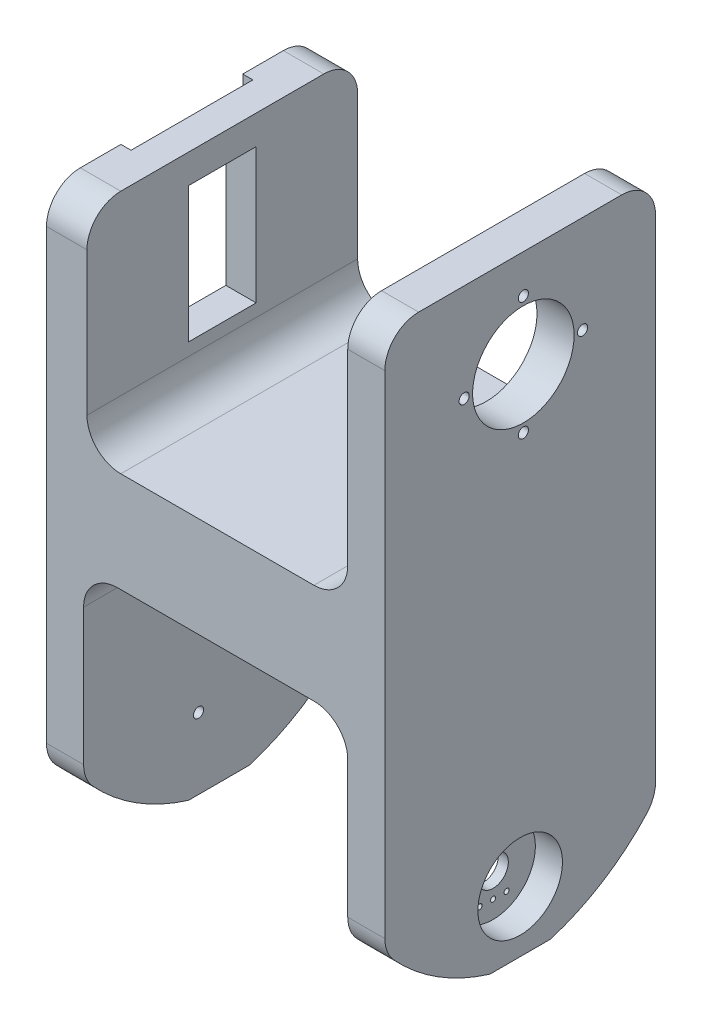
from build123d import *

# Parameters (mm, degrees)
SKETCH1_W           = 80
SKETCH1_H           = 180
BOSS_EXTRUDE1_DEPTH = 100
SKETCH2_W           = 78.07363092
SKETCH2_H           = 74.951044638
CUT_EXTRUDE1_DEPTH  = 90
SKETCH3_R           = 12.5
CUT_EXTRUDE2_DEPTH  = 8
SKETCH4_R           = 0.75
CUT_EXTRUDE3_DEPTH  = 8
SKETCH5_R           = 1.5
CUT_EXTRUDE4_DEPTH  = 18
CUT_EXTRUDE5_DEPTH  = 110
SKETCH8_W           = 78.07363092
SKETCH8_H           = 150.808878852
CUT_EXTRUDE7_DEPTH  = 110
SKETCH12_W          = 80
SKETCH12_H          = 75.404439426
BOSS_EXTRUDE2_DEPTH = 1
SKETCH13_W          = 20
SKETCH13_H          = 40
CUT_EXTRUDE9_DEPTH  = 18
SKETCH14_W          = 36.018811194
SKETCH14_H          = 61.676046566
CUT_EXTRUDE10_DEPTH = 3
SKETCH15_W          = 80
SKETCH15_H          = 13.072149311
CUT_EXTRUDE11_DEPTH = 30
SKETCH16_R          = 15
CUT_EXTRUDE12_DEPTH = 30
SKETCH17_R          = 1.5
CUT_EXTRUDE13_DEPTH = 13
FILLET1_R           = 10
FILLET2_R           = 10
FILLET3_R           = 10


with BuildPart() as part:
    # Sketch1 → Boss-Extrude1 (new body)
    with BuildSketch(Plane(origin=(0, 0, 0), x_dir=(0, 0, -1), z_dir=(1, 0, 0))):
        Rectangle(SKETCH1_W, SKETCH1_H)
    extrude(amount=BOSS_EXTRUDE1_DEPTH)

    # Sketch2 → Cut-Extrude1 (cut)
    with BuildSketch(Plane.XY.offset(40)):
        with Locations((50, -52.524477681)):
            Rectangle(SKETCH2_W, SKETCH2_H)
    extrude(amount=-CUT_EXTRUDE1_DEPTH, mode=Mode.SUBTRACT)

    # Sketch3 → Cut-Extrude2 (cut)
    with BuildSketch(Plane(origin=(100, 0, 0), x_dir=(0, 0, -1), z_dir=(1, 0, 0))):
        with Locations((0, -72)):
            Circle(SKETCH3_R)
    extrude(amount=-CUT_EXTRUDE2_DEPTH, mode=Mode.SUBTRACT)

    # Sketch4 → Cut-Extrude3 (cut)
    with BuildSketch(Plane.ZY.offset(-89.03681546)):
        with BuildLine():
            ThreePointArc((-4.5, -72), (0, -76.5), (4.5, -72))
            Line((4.5, -72), (-4.5, -72))
        make_face()
        with BuildLine():
            Line((-4.5, -72), (4.5, -72))
            ThreePointArc((4.5, -72), (0, -67.5), (-4.5, -72))
        make_face()
        with Locations(Location((-4, -64.75, 0), (0, 0, 270))):
            Circle(SKETCH4_R)
        with Locations(Location((0, -64.75, 0), (0, 0, 270))):
            Circle(SKETCH4_R)
        with Locations(Location((4, -64.75, 0), (0, 0, 270))):
            Circle(SKETCH4_R)
        with Locations(Location((4, -79.25, 0), (0, 0, 270))):
            Circle(SKETCH4_R)
        with Locations(Location((0, -79.25, 0), (0, 0, 270))):
            Circle(SKETCH4_R)
        with Locations(Location((-4, -79.25, 0), (0, 0, 270))):
            Circle(SKETCH4_R)
    extrude(amount=-CUT_EXTRUDE3_DEPTH, mode=Mode.SUBTRACT)

    # Sketch5 → Cut-Extrude4 (cut)
    with BuildSketch(Plane.ZY):
        with Locations((6.03, -69)):
            Circle(SKETCH5_R)
    extrude(amount=-CUT_EXTRUDE4_DEPTH, mode=Mode.SUBTRACT)

    # Sketch6 → Cut-Extrude5 (cut)
    with BuildSketch(Plane(origin=(100, 0, 0), x_dir=(0, 0, -1), z_dir=(1, 0, 0))):
        with BuildLine():
            Line((40, -69.065791889), (40, -90))
            Line((40, -90), (8.943223126, -90))
            ThreePointArc((8.943223126, -90), (26.043708831, -81.865168262), (40, -69.065791889))
        make_face()
        with BuildLine():
            Line((-40, -69.065791889), (-40, -90))
            Line((-40, -90), (-8.943223126, -90))
            ThreePointArc((-8.943223126, -90), (-26.043708831, -81.865168262), (-40, -69.065791889))
        make_face()
    extrude(amount=-CUT_EXTRUDE5_DEPTH, mode=Mode.SUBTRACT)

    # Sketch8 → Cut-Extrude7 (cut)
    with BuildSketch(Plane.XY.offset(40)):
        with Locations((50, 90)):
            Rectangle(SKETCH8_W, SKETCH8_H)
    extrude(amount=-CUT_EXTRUDE7_DEPTH, mode=Mode.SUBTRACT)

    # Sketch12 → Boss-Extrude2 (add)
    with BuildSketch(Plane(origin=(10.96318454, 0, 0), x_dir=(0, 0, -1), z_dir=(1, 0, 0))):
        with Locations((0, 52.297780287)):
            Rectangle(SKETCH12_W, SKETCH12_H)
    extrude(amount=BOSS_EXTRUDE2_DEPTH)

    # Sketch13 → Cut-Extrude9 (cut)
    with BuildSketch(Plane.ZY):
        with Locations((0, 48.337059594)):
            Rectangle(SKETCH13_W, SKETCH13_H)
    extrude(amount=-CUT_EXTRUDE9_DEPTH, mode=Mode.SUBTRACT)

    # Sketch14 → Cut-Extrude10 (cut)
    with BuildSketch(Plane.ZY):
        with Locations((0, 47.120499576)):
            Rectangle(SKETCH14_W, SKETCH14_H)
    extrude(amount=-CUT_EXTRUDE10_DEPTH, mode=Mode.SUBTRACT)

    # Sketch15 → Cut-Extrude11 (cut)
    with BuildSketch(Plane(origin=(11.96318454, 0, 0), x_dir=(0, 0, -1), z_dir=(1, 0, 0))):
        with Locations((0, 83.463925345)):
            Rectangle(SKETCH15_W, SKETCH15_H)
    extrude(amount=-CUT_EXTRUDE11_DEPTH, mode=Mode.SUBTRACT)

    # Sketch16 → Cut-Extrude12 (cut)
    with BuildSketch(Plane(origin=(100, 0, 0), x_dir=(0, 0, -1), z_dir=(1, 0, 0))):
        with Locations((0.94, 61.16)):
            Circle(SKETCH16_R)
    extrude(amount=-CUT_EXTRUDE12_DEPTH, mode=Mode.SUBTRACT)

    # Sketch17 → Cut-Extrude13 (cut)
    with BuildSketch(Plane(origin=(100, 0, 0), x_dir=(0, 0, -1), z_dir=(1, 0, 0))):
        with Locations((0.94, 78.66)):
            Circle(SKETCH17_R)
        with Locations((18.44, 61.16)):
            Circle(SKETCH17_R)
        with Locations((0.94, 43.66)):
            Circle(SKETCH17_R)
        with Locations((-16.56, 61.16)):
            Circle(SKETCH17_R)
    extrude(amount=-CUT_EXTRUDE13_DEPTH, mode=Mode.SUBTRACT)

    # Fillet1
    fillet1_edges = [part.edges().sort_by_distance(p)[0] for p in [
        (89.03681546, 14.595560574, 0),
        (11.96318454, 14.595560574, 0),
        (89.03681546, -15.048955362, 0),
        (10.96318454, -15.048955362, 0),
    ]]
    fillet(fillet1_edges, radius=FILLET1_R)

    # Fillet2
    fillet2_edges = [part.edges().sort_by_distance(p)[0] for p in [
        (5.98159227, 76.927850689, 40),
        (5.98159227, 76.927850689, -40),
        (94.51840773, 90, 40),
        (94.51840773, 90, -40),
    ]]
    fillet(fillet2_edges, radius=FILLET2_R)

    # Fillet3
    fillet3_edges = [part.edges().sort_by_distance(p)[0] for p in [
        (94.51840773, -69.065791889, 40),
        (5.48159227, -69.065791889, 40),
        (94.51840773, -69.065791889, -40),
        (5.48159227, -69.065791889, -40),
    ]]
    fillet(fillet3_edges, radius=FILLET3_R)


solid = part.part
